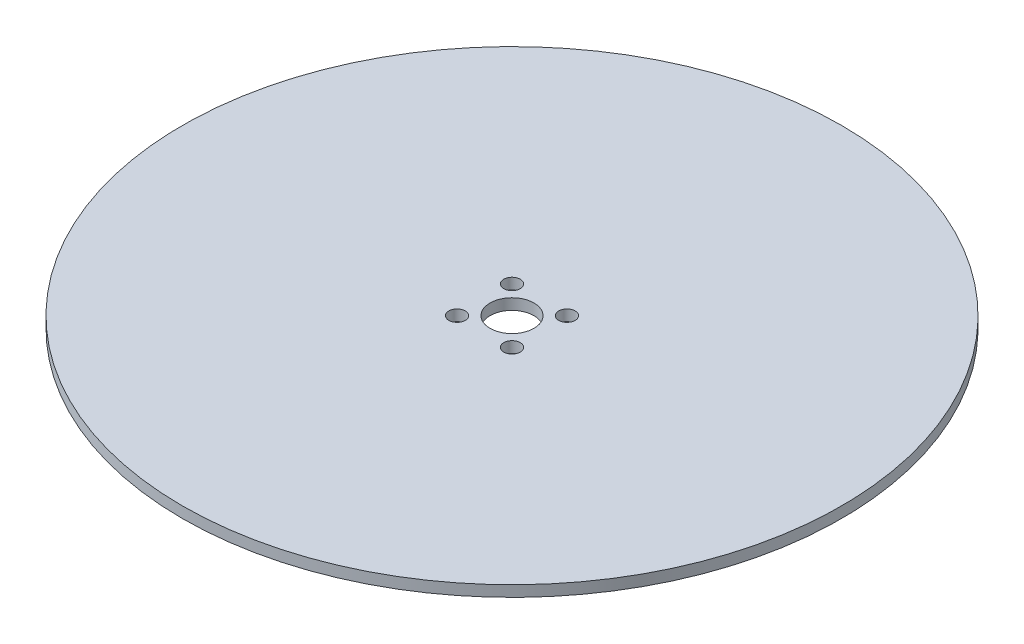
from build123d import *

# Parameters (mm, degrees)
SKETCH_1_R          = 60
EXTRUDE_1_DEPTH     = 2
SKETCH_2_R          = 4
CUT_EXTRUDE_1_DEPTH = 2


with BuildPart() as part:
    # 草图1 → 凸台-拉伸1 (new body)
    with BuildSketch(Plane(origin=(0, 0, 0), x_dir=(1, 0, 0), z_dir=(0, 1, 0))):
        with Locations(Location((0, 0, 0), (0, 0, 270))):
            Circle(SKETCH_1_R)
    extrude(amount=EXTRUDE_1_DEPTH)

    # 草图2 → 切除-拉伸1 (cut)
    with BuildSketch(Plane(origin=(0, 2, 0), x_dir=(1, 0, 0), z_dir=(0, 1, 0))):
        with BuildLine():
            ThreePointArc((-3.5, 5), (-6.060660172, 6.060660172), (-5, 3.5))
            Line((-5, 3.5), (-5, 5))
            Line((-5, 5), (-3.5, 5))
        make_face()
        with BuildLine():
            Line((-5, 5), (-5, 3.5))
            ThreePointArc((-5, 3.5), (-3.939339828, 3.939339828), (-3.5, 5))
            Line((-3.5, 5), (-5, 5))
        make_face()
        with BuildLine():
            ThreePointArc((3.5, 5), (3.939339828, 3.939339828), (5, 3.5))
            Line((5, 3.5), (5, 5))
            Line((5, 5), (3.5, 5))
        make_face()
        with BuildLine():
            Line((5, 5), (5, 3.5))
            ThreePointArc((5, 3.5), (6.060660172, 3.939339828), (6.5, 5))
            ThreePointArc((6.5, 5), (5, 6.5), (3.5, 5))
            Line((3.5, 5), (5, 5))
        make_face()
        with Locations(Location((0, 0, 0), (0, 0, 270))):
            Circle(SKETCH_2_R)
        with BuildLine():
            ThreePointArc((5, -3.5), (3.939339828, -3.939339828), (3.5, -5))
            Line((3.5, -5), (5, -5))
            Line((5, -5), (5, -3.5))
        make_face()
        with BuildLine():
            Line((5, -5), (3.5, -5))
            ThreePointArc((3.5, -5), (5, -6.5), (6.5, -5))
            ThreePointArc((6.5, -5), (6.060660172, -3.939339828), (5, -3.5))
            Line((5, -3.5), (5, -5))
        make_face()
        with BuildLine():
            ThreePointArc((-5, -3.5), (-6.060660172, -6.060660172), (-3.5, -5))
            Line((-3.5, -5), (-5, -5))
            Line((-5, -5), (-5, -3.5))
        make_face()
        with BuildLine():
            Line((-5, -5), (-3.5, -5))
            ThreePointArc((-3.5, -5), (-3.939339828, -3.939339828), (-5, -3.5))
            Line((-5, -3.5), (-5, -5))
        make_face()
    extrude(amount=-CUT_EXTRUDE_1_DEPTH, mode=Mode.SUBTRACT)


solid = part.part
